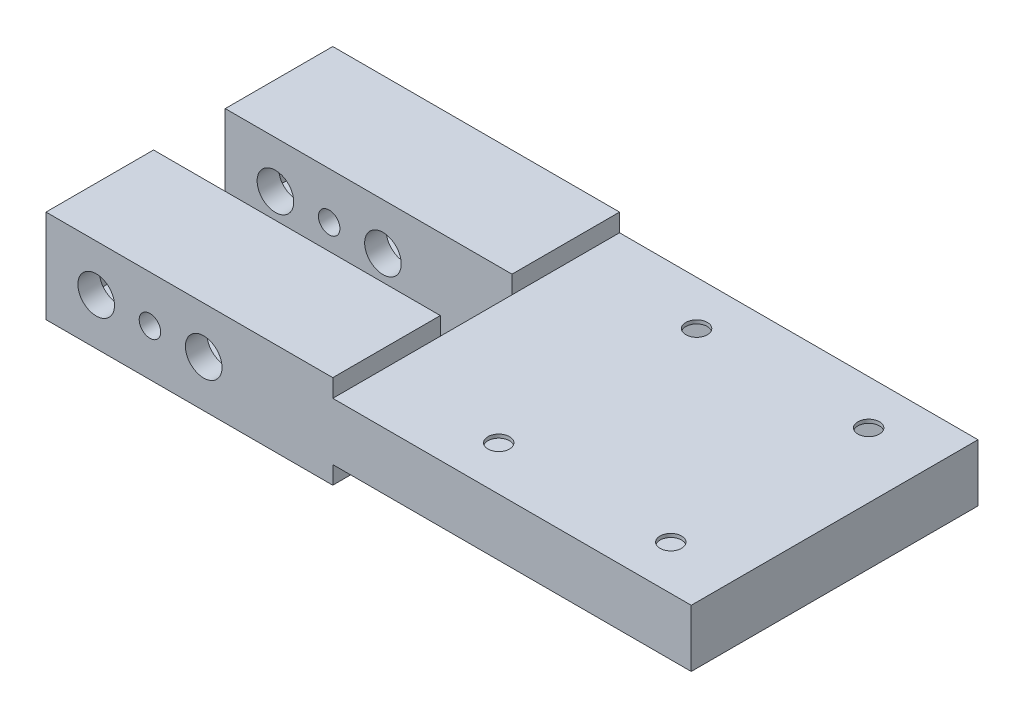
from build123d import *

# Parameters (mm, degrees)
BOSS_EXTRUDE1_DEPTH             = 5
BOSS_EXTRUDE1_DEPTH_BACK        = 5
SHELL1_T                        = -3
BOSS_EXTRUDE2_START             = 5
BOSS_EXTRUDE2_DEPTH             = 3
SKETCH2_R                       = 1.5
CUT_EXTRUDE1_DEPTH              = 100
SKETCH9_W                       = 40
SKETCH9_H                       = 2.5
CUT_EXTRUDE2_DEPTH              = 77.739820172
SKETCH10_W                      = 10
SKETCH10_H                      = 40
CUT_EXTRUDE3_DEPTH              = 2.5
CUT_EXTRUDE4_START              = -10.5
SKETCH10_2_W                    = 10
SKETCH10_2_H                    = 40
CUT_EXTRUDE4_DEPTH              = 2.5
F_3_0MM_CLEARANCE_DOWEL_HOLE1_D = 3
F_1_4_20_TAPPED_HOLE1_D         = 5.1054


with BuildPart() as part:
    # Sketch1 → Boss-Extrude1 (new, two sides: drawn at the far end of the back side and taken through both)
    with BuildSketch(Plane(origin=(0, 0, 0), x_dir=(1, 0, 0), z_dir=(0, 1, 0)).offset(-BOSS_EXTRUDE1_DEPTH_BACK)):
        Polygon((15, -5), (-25, -5), (-25, -20), (25, -20), (65, -20), (65, 20), (25, 20), (-25, 20), (-25, 5), (15, 5), align=None)
    extrude(amount=BOSS_EXTRUDE1_DEPTH + BOSS_EXTRUDE1_DEPTH_BACK)

    # Shell1
    shell1_openings = [part.faces().sort_by_distance(p)[0] for p in [
        (23.125, 5, 0),
    ]]
    offset(amount=SHELL1_T, openings=shell1_openings, kind=Kind.INTERSECTION)

    # Sketch1<2> → Boss-Extrude2 (add)
    with BuildSketch(Plane(origin=(0, 0, 0), x_dir=(1, 0, 0), z_dir=(0, 1, 0)).offset(BOSS_EXTRUDE2_START)):
        Polygon((15, -5), (-25, -5), (-25, -20), (25, -20), (65, -20), (65, 20), (25, 20), (-25, 20), (-25, 5), (15, 5), align=None)
    extrude(amount=BOSS_EXTRUDE2_DEPTH)

    # Sketch2 → Cut-Extrude1 (cut)
    with BuildSketch(Plane.XY.offset(20)):
        with Locations((-10.5, 1.5)):
            Circle(SKETCH2_R)
    extrude(amount=-CUT_EXTRUDE1_DEPTH, mode=Mode.SUBTRACT)

    # Sketch9 → Cut-Extrude2 (cut, through all)
    with BuildSketch(Plane.XY.offset(20)):
        with Locations((45, 6.75)):
            Rectangle(SKETCH9_W, SKETCH9_H)
        with Locations((45, -3.75)):
            Rectangle(SKETCH9_W, SKETCH9_H)
    extrude(amount=-CUT_EXTRUDE2_DEPTH, mode=Mode.SUBTRACT)

    # Sketch10 → Cut-Extrude3 (cut)
    with BuildSketch(Plane(origin=(0, 8, 0), x_dir=(1, 0, 0), z_dir=(0, 1, 0))):
        with Locations((20, 0)):
            Rectangle(SKETCH10_W, SKETCH10_H)
    extrude(amount=-CUT_EXTRUDE3_DEPTH, mode=Mode.SUBTRACT)

    # Sketch10<2> → Cut-Extrude4 (cut)
    with BuildSketch(Plane(origin=(0, 8, 0), x_dir=(1, 0, 0), z_dir=(0, 1, 0)).offset(CUT_EXTRUDE4_START)):
        with Locations((20, 0)):
            Rectangle(SKETCH10_2_W, SKETCH10_2_H)
    extrude(amount=-CUT_EXTRUDE4_DEPTH, mode=Mode.SUBTRACT)

    # Ø3.0mm Clearance Dowel Hole1 (through all)
    with Locations(Plane(origin=(0, 5.5, 0), x_dir=(1, 0, 0), z_dir=(0, 1, 0))):
        with Locations((31.950000364, 13.8), (31.950000364, -13.8), (55.950000364, -13.8), (55.950000364, 13.8)):
            Hole(F_3_0MM_CLEARANCE_DOWEL_HOLE1_D / 2)

    # 1/4-20 Tapped Hole1 (through all)
    with Locations(Plane.XY.offset(20)):
        with Locations((-18, 1.5), (-3, 1.5)):
            Hole(F_1_4_20_TAPPED_HOLE1_D / 2)


solid = part.part
